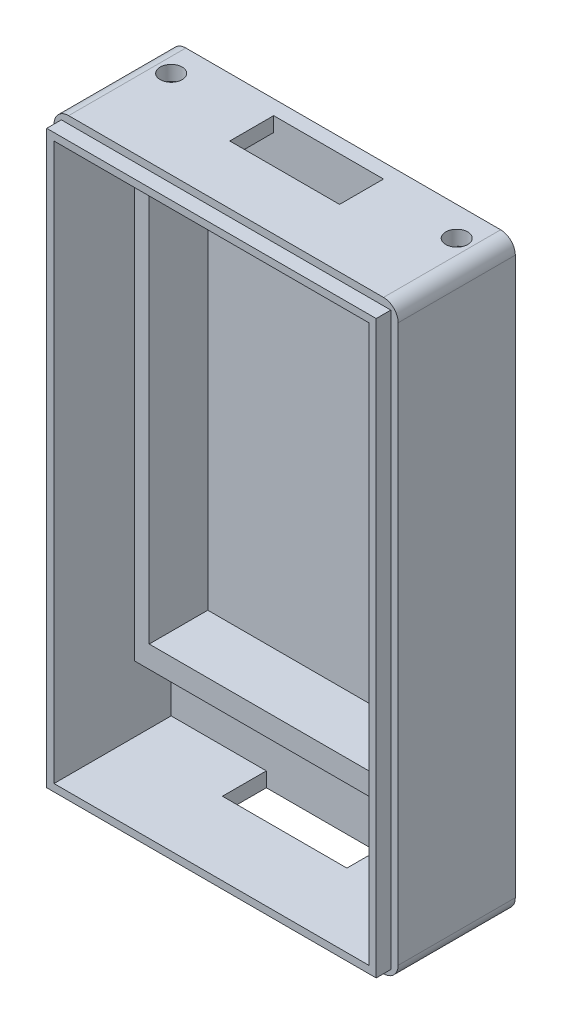
from build123d import *

# Parameters (mm, degrees)
SKETCH1_W           = 47
SKETCH1_H           = 80
BOSS_EXTRUDE1_DEPTH = 18
SKETCH2_W           = 43
SKETCH2_H           = 76
CUT_EXTRUDE1_DEPTH  = 16
BOSS_EXTRUDE2_DEPTH = 8
SKETCH6_W           = 15
SKETCH6_H           = 6
CUT_EXTRUDE4_DEPTH  = 11
SKETCH8_W           = 47
SKETCH8_H           = 80
SKETCH8_W_2         = 45
SKETCH8_H_2         = 78
CUT_EXTRUDE5_DEPTH  = 2
SKETCH9_R           = 1.5
CUT_EXTRUDE6_DEPTH  = 10
SKETCH11_W          = 17
SKETCH11_H          = 6
CUT_EXTRUDE9_DEPTH  = 10
FILLET4_R           = 2


with BuildPart() as part:
    # Sketch1 → Boss-Extrude1 (new body)
    with BuildSketch(Plane.XY):
        Rectangle(SKETCH1_W, SKETCH1_H)
    extrude(amount=BOSS_EXTRUDE1_DEPTH)

    # Sketch2 → Cut-Extrude1 (cut)
    with BuildSketch(Plane.XY.offset(18)):
        Rectangle(SKETCH2_W, SKETCH2_H)
    extrude(amount=-CUT_EXTRUDE1_DEPTH, mode=Mode.SUBTRACT)

    # Sketch3 → Boss-Extrude2 (add)
    with BuildSketch(Plane.XY.offset(2)):
        Polygon((-18.5, 38), (-16.5, 38), (-16.5, -23), (16.5, -23), (16.5, 38), (18.5, 38), (18.5, -26), (-18.5, -26), align=None)
    extrude(amount=BOSS_EXTRUDE2_DEPTH)

    # Sketch6 → Cut-Extrude4 (cut)
    with BuildSketch(Plane.XZ.offset(-38)):
        with Locations((0, 5)):
            Rectangle(SKETCH6_W, SKETCH6_H)
    extrude(amount=-CUT_EXTRUDE4_DEPTH, mode=Mode.SUBTRACT)

    # Sketch8 → Cut-Extrude5 (cut)
    with BuildSketch(Plane.XY.offset(18)):
        Rectangle(SKETCH8_W, SKETCH8_H)
        Rectangle(SKETCH8_W_2, SKETCH8_H_2, mode=Mode.SUBTRACT)
    extrude(amount=-CUT_EXTRUDE5_DEPTH, mode=Mode.SUBTRACT)

    # Sketch9 → Cut-Extrude6 (cut)
    with BuildSketch(Plane(origin=(0, 40, 0), x_dir=(1, 0, 0), z_dir=(0, 1, 0))):
        with Locations(Location((-19.5, -4, 0), (0, 0, 270))):
            Circle(SKETCH9_R)
        with Locations(Location((19.5, -4, 0), (0, 0, 228.189685104))):
            Circle(SKETCH9_R)
    extrude(amount=-CUT_EXTRUDE6_DEPTH, mode=Mode.SUBTRACT)

    # Sketch11 → Cut-Extrude9 (cut)
    with BuildSketch(Plane(origin=(0, -38, 0), x_dir=(1, 0, 0), z_dir=(0, 1, 0))):
        with Locations((0, -5)):
            Rectangle(SKETCH11_W, SKETCH11_H)
    extrude(amount=-CUT_EXTRUDE9_DEPTH, mode=Mode.SUBTRACT)

    # Fillet4
    fillet4_edges = [part.edges().sort_by_distance(p)[0] for p in [
        (23.5, -40, 8),
        (-23.5, -40, 8),
        (-23.5, 40, 8),
        (23.5, 40, 8),
    ]]
    fillet(fillet4_edges, radius=FILLET4_R)


solid = part.part
